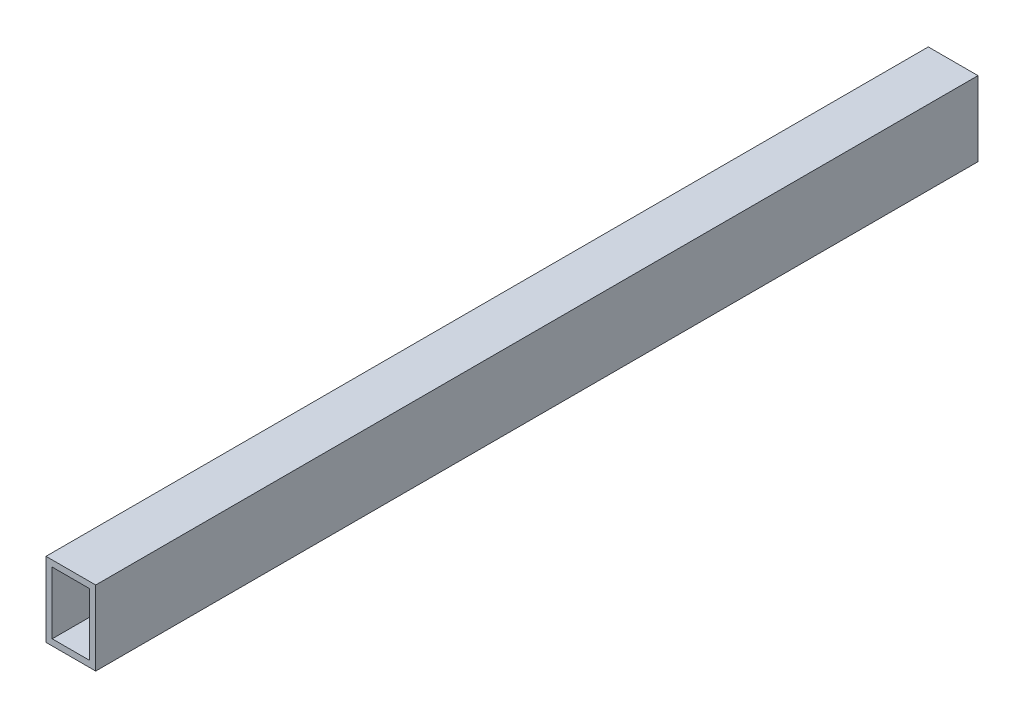
from build123d import *

# Parameters (mm, degrees)
SKETCH1_W           = 50.8
SKETCH1_H           = 76.2
SKETCH1_W_2         = 38.1
SKETCH1_H_2         = 63.5
BOSS_EXTRUDE1_DEPTH = 901.7


with BuildPart() as part:
    # Sketch1 → Boss-Extrude1 (new body)
    with BuildSketch(Plane.XY):
        Rectangle(SKETCH1_W, SKETCH1_H)
        Rectangle(SKETCH1_W_2, SKETCH1_H_2, mode=Mode.SUBTRACT)
    extrude(amount=BOSS_EXTRUDE1_DEPTH)


solid = part.part
